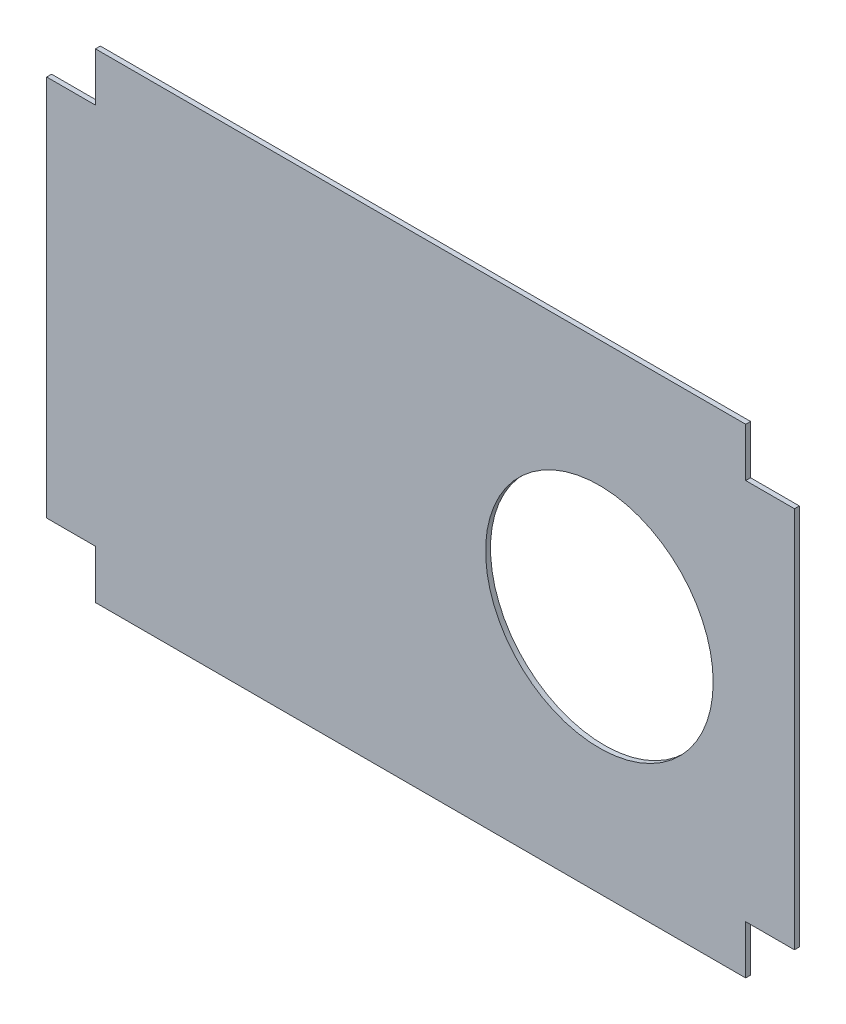
from build123d import *

# Parameters (mm, degrees)
SKICA1_R                = 70
P_IDAT_VYSUNUT_M1_DEPTH = 3


with BuildPart() as part:
    # Skica1 → Přidat vysunutím1 (new body)
    with BuildSketch(Plane.XY):
        Polygon((-290.816426189, 41.996197719), (-290.816426189, -193.003802281), (-260.816426189, -193.003802281), (-260.816426189, -223.003802281), (139.183573811, -223.003802281), (139.183573811, -193.003802281), (169.183573811, -193.003802281), (169.183573811, 41.996197719), (139.183573811, 41.996197719), (139.183573811, 71.996197719), (-260.816426189, 71.996197719), (-260.816426189, 41.996197719), align=None)
        with Locations((49.183573811, -75.503802281)):
            Circle(SKICA1_R, mode=Mode.SUBTRACT)
    extrude(amount=P_IDAT_VYSUNUT_M1_DEPTH)


solid = part.part
